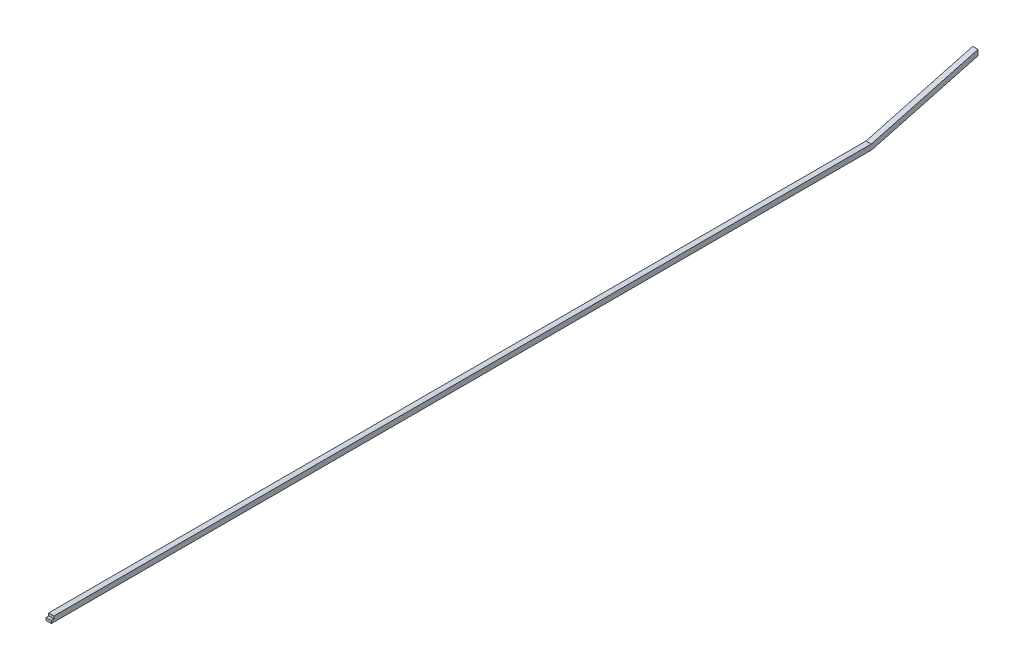
from build123d import *

# Parameters (mm, degrees)
EXTRUDE_1_DEPTH = 6


with BuildPart() as part:
    # Эскиз1 → Бобышка-Вытянуть1 (new body)
    with BuildSketch(Plane(origin=(0, 0, 0), x_dir=(0, 0, -1), z_dir=(1, 0, 0))):
        Polygon((-413.956983993, 0), (514.903016007, 0), (634.899981407, 32.153089973), (634.899981407, 38.364747056), (514.113101021, 6), (-410.956983993, 6), (-410.956983993, 3), (-413.956983993, 3), align=None)
    extrude(amount=EXTRUDE_1_DEPTH)


solid = part.part
